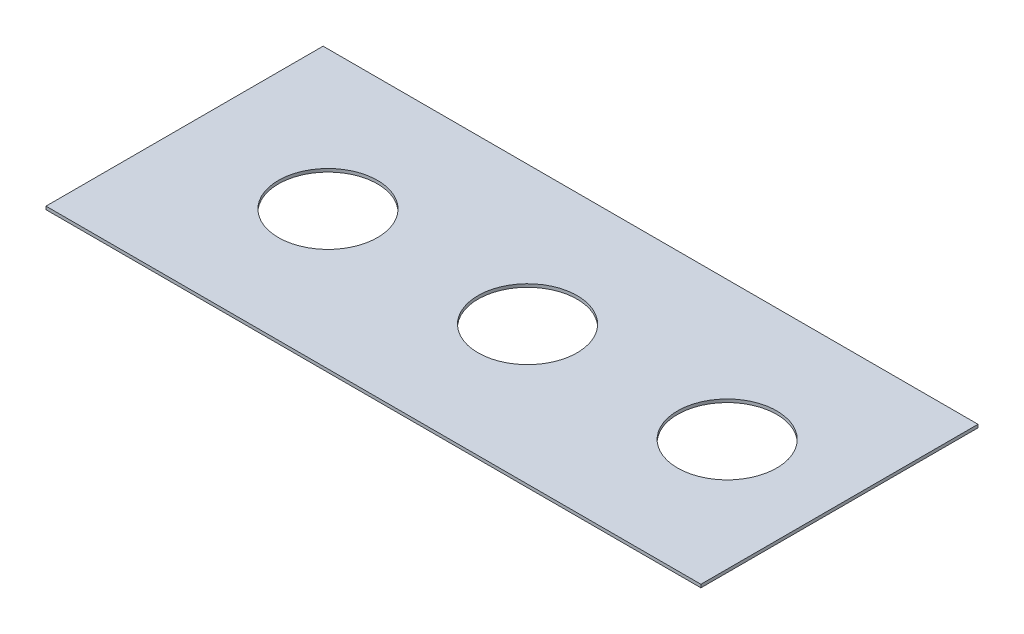
from build123d import *

# Parameters (mm, degrees)
SKETCH1_W           = 330.2
SKETCH1_H           = 139.7
SKETCH1_R           = 24.9936
BOSS_EXTRUDE1_DEPTH = 1.5748


with BuildPart() as part:
    # Sketch1 → Boss-Extrude1 (new body)
    with BuildSketch(Plane(origin=(0, 0, 0), x_dir=(1, 0, 0), z_dir=(0, 1, 0))):
        Rectangle(SKETCH1_W, SKETCH1_H)
        with Locations(Location((-92.7862, 0, 0), (0, 0, 270))):
            Circle(SKETCH1_R, mode=Mode.SUBTRACT)
        with Locations(Location((7.8486, 0, 0), (0, 0, 270))):
            Circle(SKETCH1_R, mode=Mode.SUBTRACT)
        with Locations(Location((108.4834, 0, 0), (0, 0, 270))):
            Circle(SKETCH1_R, mode=Mode.SUBTRACT)
    extrude(amount=BOSS_EXTRUDE1_DEPTH)


solid = part.part
